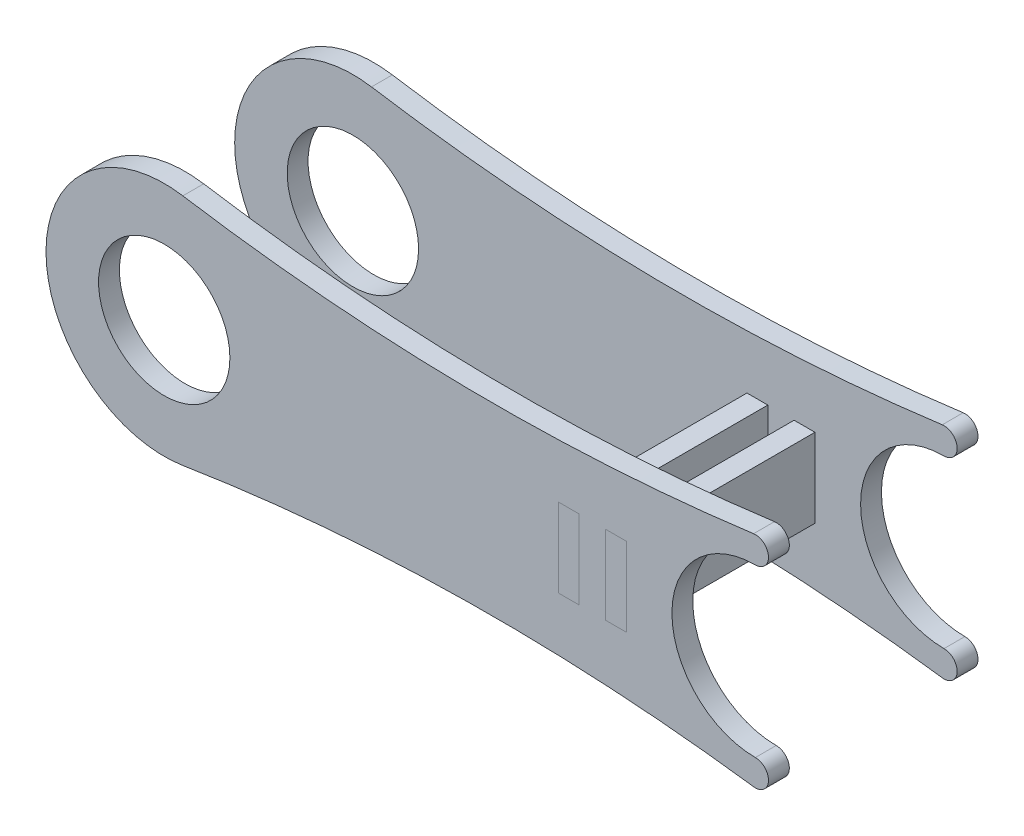
from build123d import *

# Parameters (mm, degrees)
SKETCH1_R             = 10
SKETCH1_W             = 3.175
SKETCH1_H             = 12
BOSS_EXTRUDE1_DEPTH   = 3.175
SKETCH2_W             = 3.175
SKETCH2_H             = 12
BOSS_EXTRUDE2_DEPTH   = 31.9
BOSS_EXTRUDE2_2_DEPTH = 31.9


with BuildPart() as part:
    # Sketch1 → Boss-Extrude1 (new body)
    with BuildSketch(Plane.XY):
        with BuildLine():
            ThreePointArc((2.831215146, 17.775945004), (-18, 0), (2.831215146, -17.775945004))
            ThreePointArc((2.831215146, -17.775945004), (46.243406786, -14.065443628), (89.735219432, -16.682395332))
            ThreePointArc((89.735219432, -16.682395332), (91.99559398, -14.832682585), (90, -12.7))
            ThreePointArc((90, -12.7), (77.3, 0), (90, 12.7))
            ThreePointArc((90, 12.7), (91.99559398, 14.832682585), (89.735219432, 16.682395332))
            ThreePointArc((89.735219432, 16.682395332), (46.243406786, 14.065443628), (2.831215146, 17.775945004))
        make_face()
        Circle(SKETCH1_R, mode=Mode.SUBTRACT)
        with Locations((68.7625, 0)):
            Rectangle(SKETCH1_W, SKETCH1_H, mode=Mode.SUBTRACT)
        with Locations((61.5875, 0)):
            Rectangle(SKETCH1_W, SKETCH1_H, mode=Mode.SUBTRACT)
    extrude(amount=BOSS_EXTRUDE1_DEPTH)


with BuildPart() as body_2:
    # Mirror3: mirrored copy
    add(part.part.mirror(Plane(origin=(0, 0, -12.775), x_dir=(1, 0, 0), z_dir=(0, 0, -1))))


with BuildPart() as body_3:
    # Sketch2 → Boss-Extrude2 (new body)
    with BuildSketch(Plane.XY.offset(3.175)):
        with Locations((61.5875, 0)):
            Rectangle(SKETCH2_W, SKETCH2_H)
    extrude(amount=-BOSS_EXTRUDE2_DEPTH)


with BuildPart() as body_4:
    # Sketch2 → Boss-Extrude2 2 (new body)
    with BuildSketch(Plane.XY.offset(3.175)):
        with Locations((68.7625, 0)):
            Rectangle(SKETCH2_W, SKETCH2_H)
    extrude(amount=-BOSS_EXTRUDE2_2_DEPTH)


solid = Compound([part.part, body_2.part, body_3.part, body_4.part])
